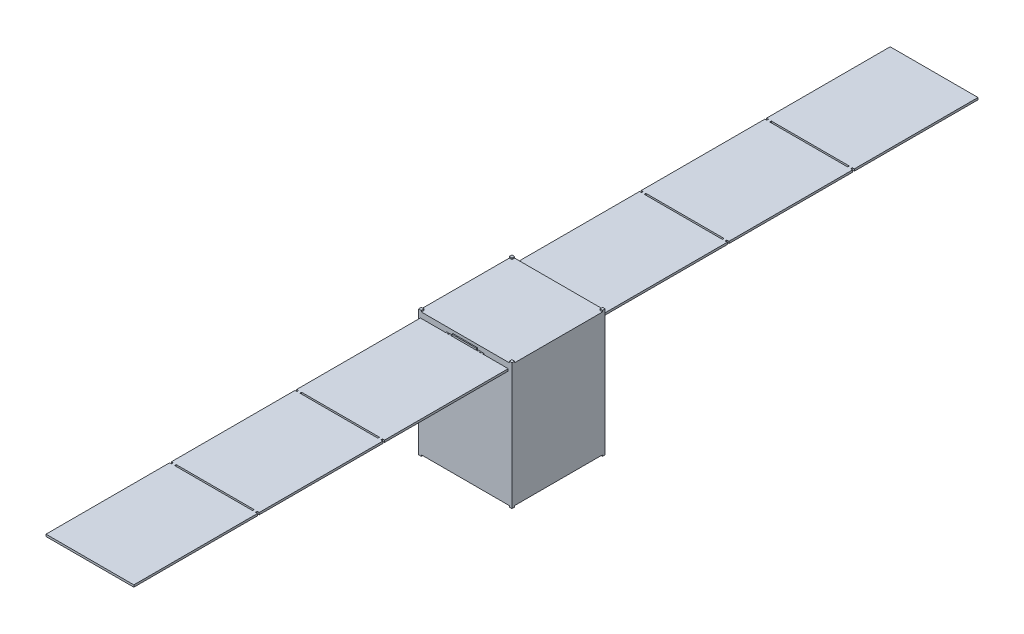
from build123d import *

# Parameters (mm, degrees)
ESTRUSIONE_ESTRUSIONE2_DEPTH      = 150
ESTRUSIONE_ESTRUSIONE2_DEPTH_BACK = 150
ESTRUSIONE_ESTRUSIONE3_DEPTH      = 3.3
ESTRUSIONE_ESTRUSIONE3_DEPTH_BACK = 303.3
SCHIZZO3_W                        = 6.5
SCHIZZO3_H                        = 6.5
SCHIZZO11_W                       = 60
SCHIZZO11_H                       = 4
ESTRUSIONE_ESTRUSIONE10_DEPTH     = 2.5
ESTRUSIONE_ESTRUSIONE11_DEPTH     = 2.5
ESTRUSIONE_ESTRUSIONE12_DEPTH     = 4.5
SCHIZZO13_W                       = 213
SCHIZZO13_H                       = 5
ESTRUSIONE_ESTRUSIONE13_DEPTH     = 300
SCHIZZO15_W                       = 7
SCHIZZO15_H                       = 5
ESTRUSIONE_ESTRUSIONE14_DEPTH     = 4
SCHIZZO16_W                       = 213
SCHIZZO16_H                       = 5
ESTRUSIONE_ESTRUSIONE15_DEPTH     = 300
RIPETIZIONE_A_L2_COUNT            = 2
RIPETIZIONE_A_L2_PITCH            = 304
SPECCHIA2_COPY_1_SKETCH_W         = 7
SPECCHIA2_COPY_1_SKETCH_H         = 5
SPECCHIA2_COPY_1_DEPTH            = 4
SPECCHIA2_COPY_2_SKETCH_W         = 213
SPECCHIA2_COPY_2_SKETCH_H         = 5
SPECCHIA2_COPY_2_DEPTH            = 300


with BuildPart() as part:
    # Schizzo2 → Estrusione-Estrusione2 (new, two sides: drawn at the far end of the back side and taken through both)
    with BuildSketch(Plane(origin=(0, 0, 0), x_dir=(1, 0, 0), z_dir=(0, 1, 0)).offset(-ESTRUSIONE_ESTRUSIONE2_DEPTH_BACK)):
        Polygon((-113.15, 106.65), (-113.15, -106.65), (-106.65, -106.65), (-106.65, -113.15), (106.65, -113.15), (106.65, -106.65), (113.15, -106.65), (113.15, 106.65), (106.65, 106.65), (106.65, 113.15), (-106.65, 113.15), (-106.65, 106.65), align=None)
    extrude(amount=ESTRUSIONE_ESTRUSIONE2_DEPTH + ESTRUSIONE_ESTRUSIONE2_DEPTH_BACK)

    # Schizzo3 → Estrusione-Estrusione3 (add, two sides: drawn at the far end of the back side and taken through both)
    with BuildSketch(Plane.XZ.offset(150).offset(-ESTRUSIONE_ESTRUSIONE3_DEPTH_BACK)):
        with Locations((-109.9, 109.9)):
            Rectangle(SCHIZZO3_W, SCHIZZO3_H)
        with Locations((109.9, 109.9)):
            Rectangle(SCHIZZO3_W, SCHIZZO3_H)
        with Locations((109.9, -109.9)):
            Rectangle(SCHIZZO3_W, SCHIZZO3_H)
        with Locations((-109.9, -109.9)):
            Rectangle(SCHIZZO3_W, SCHIZZO3_H)
    extrude(amount=ESTRUSIONE_ESTRUSIONE3_DEPTH + ESTRUSIONE_ESTRUSIONE3_DEPTH_BACK)

    # Schizzo11 → Estrusione-Estrusione10 (add)
    with BuildSketch(Plane(origin=(0, 0, -113.15), x_dir=(-1, 0, 0), z_dir=(0, 0, -1))):
        with Locations((0, 141)):
            Rectangle(SCHIZZO11_W, SCHIZZO11_H)
    estrusione_estrusione10 = extrude(amount=ESTRUSIONE_ESTRUSIONE10_DEPTH)

    # Schizzo11<5> → Estrusione-Estrusione11 (add)
    with BuildSketch(Plane(origin=(0, 0, -113.15), x_dir=(-1, 0, 0), z_dir=(0, 0, -1))):
        Polygon((30, 139), (-30, 139), (-45, 139), (-45, 135.5), (-43, 135.5), (-43, 133.75), (0, 133.75), (43, 133.75), (43, 135.5), (45, 135.5), (45, 139), align=None)
    estrusione_estrusione11 = extrude(amount=ESTRUSIONE_ESTRUSIONE11_DEPTH)

    # Schizzo11<8> → Estrusione-Estrusione12 (add)
    with BuildSketch(Plane(origin=(0, 0, -113.15), x_dir=(-1, 0, 0), z_dir=(0, 0, -1))):
        Polygon((-43, 135.5), (-45, 135.5), (-45, 132), (45, 132), (45, 135.5), (43, 135.5), (43, 133.75), (-43, 133.75), align=None)
    estrusione_estrusione12 = extrude(amount=ESTRUSIONE_ESTRUSIONE12_DEPTH)

    # Schizzo13 → Estrusione-Estrusione13 (add)
    with BuildSketch(Plane(origin=(0, 0, -115.65), x_dir=(-1, 0, 0), z_dir=(0, 0, -1))):
        with Locations((-0.15, 136.25)):
            Rectangle(SCHIZZO13_W, SCHIZZO13_H)
    estrusione_estrusione13 = extrude(amount=ESTRUSIONE_ESTRUSIONE13_DEPTH)

    # Schizzo15 → Estrusione-Estrusione14 (add)
    with BuildSketch(Plane(origin=(0, 0, -415.65), x_dir=(-1, 0, 0), z_dir=(0, 0, -1))):
        with Locations((-98.15, 136.25)):
            Rectangle(SCHIZZO15_W, SCHIZZO15_H)
        with Locations((98.15, 136.25)):
            Rectangle(SCHIZZO15_W, SCHIZZO15_H)
    estrusione_estrusione14 = extrude(amount=ESTRUSIONE_ESTRUSIONE14_DEPTH)

    # Schizzo16 → Estrusione-Estrusione15 (add)
    with BuildSketch(Plane(origin=(0, 0, -419.65), x_dir=(-1, 0, 0), z_dir=(0, 0, -1))):
        with Locations((-0.15, 136.25)):
            Rectangle(SCHIZZO16_W, SCHIZZO16_H)
    estrusione_estrusione15 = extrude(amount=ESTRUSIONE_ESTRUSIONE15_DEPTH)

    # Ripetizione a L2: Estrusione-Estrusione14, Estrusione-Estrusione15 ×2
    with Locations(*[(0, 0, -i * RIPETIZIONE_A_L2_PITCH) for i in range(1, RIPETIZIONE_A_L2_COUNT)]):
        add(estrusione_estrusione14)
        add(estrusione_estrusione15)

    # Specchia2: Estrusione-Estrusione10, Estrusione-Estrusione11, Estrusione-Estrusione12, Estrusione-Estrusione13, Estrusione-Estrusione14, Estrusione-Estrusione15 across plane
    add(estrusione_estrusione10.mirror(Plane.XY))
    add(estrusione_estrusione11.mirror(Plane.XY))
    add(estrusione_estrusione12.mirror(Plane.XY))
    add(estrusione_estrusione13.mirror(Plane.XY))
    add(estrusione_estrusione14.mirror(Plane.XY))
    add(estrusione_estrusione15.mirror(Plane.XY))

    # Specchia2 copy 1 sketch → Specchia2 copy 1 (add)
    with BuildSketch(Plane(origin=(0, 0, 719.65), x_dir=(-1, 0, 0), z_dir=(0, 0, 1))):
        with Locations((-98.15, -136.25)):
            Rectangle(SPECCHIA2_COPY_1_SKETCH_W, SPECCHIA2_COPY_1_SKETCH_H)
        with Locations((98.15, -136.25)):
            Rectangle(SPECCHIA2_COPY_1_SKETCH_W, SPECCHIA2_COPY_1_SKETCH_H)
    extrude(amount=SPECCHIA2_COPY_1_DEPTH)

    # Specchia2 copy 2 sketch → Specchia2 copy 2 (add)
    with BuildSketch(Plane(origin=(0, 0, 723.65), x_dir=(-1, 0, 0), z_dir=(0, 0, 1))):
        with Locations((-0.15, -136.25)):
            Rectangle(SPECCHIA2_COPY_2_SKETCH_W, SPECCHIA2_COPY_2_SKETCH_H)
    extrude(amount=SPECCHIA2_COPY_2_DEPTH)


solid = part.part
